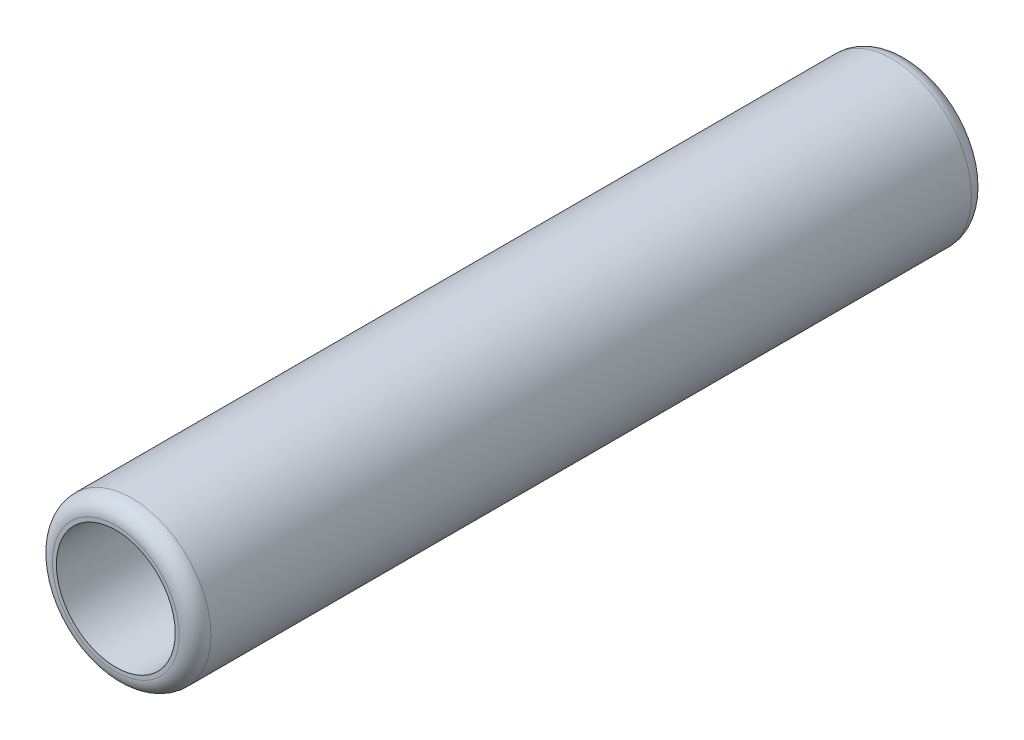
from build123d import *

# Parameters (mm, degrees)
SKETCH1_R           = 10
SKETCH1_R_2         = 7.5
BOSS_EXTRUDE1_DEPTH = 100
FILLET2_R           = 2


with BuildPart() as part:
    # Sketch1 → Boss-Extrude1 (new body)
    with BuildSketch(Plane.XY):
        Circle(SKETCH1_R)
        Circle(SKETCH1_R_2, mode=Mode.SUBTRACT)
    extrude(amount=BOSS_EXTRUDE1_DEPTH)

    # Fillet2
    fillet2_edges = [part.edges().sort_by_distance(p)[0] for p in [
        (-10, 0, 0),
        (-10, 0, 100),
    ]]
    fillet(fillet2_edges, radius=FILLET2_R)


solid = part.part
